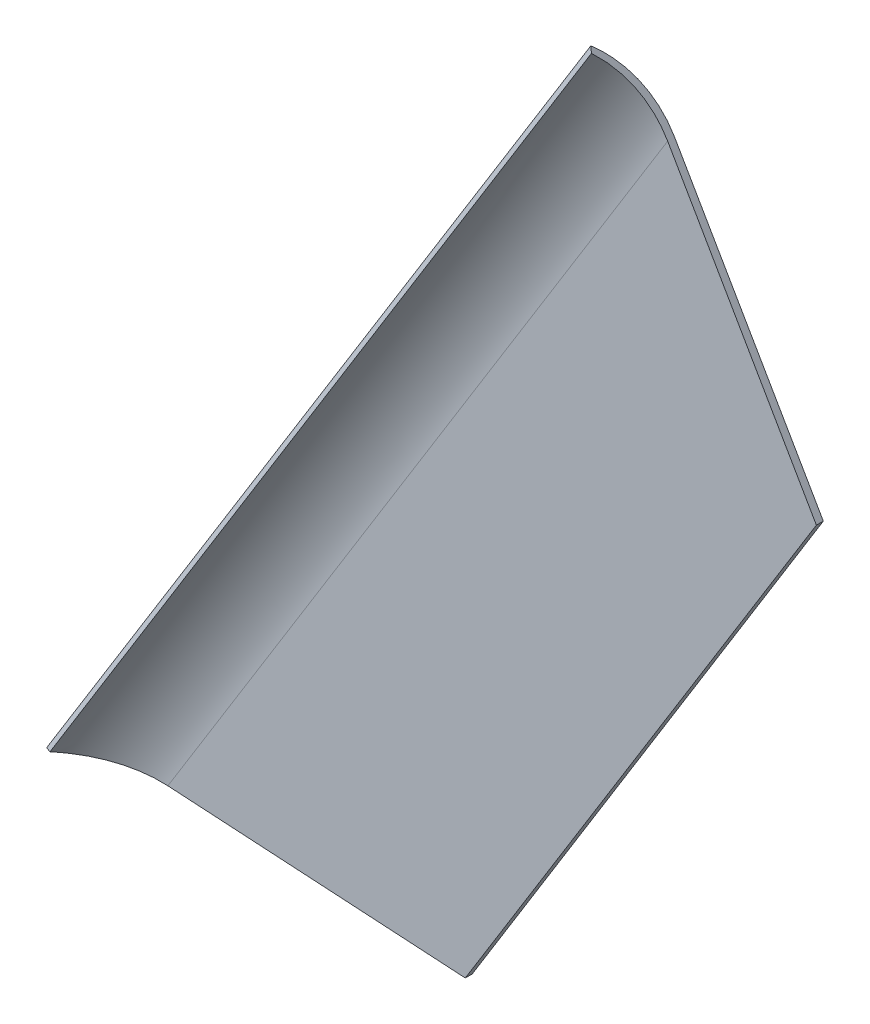
from build123d import *

# Parameters (mm, degrees)
BOSS_EXTRUDE1_DEPTH      = 1.5875
BOSS_EXTRUDE3_DEPTH      = 120
BOSS_EXTRUDE3_DEPTH_BACK = 120
CUT_EXTRUDE1_DEPTH       = 182.234838864


with BuildPart() as part:
    # Sketch1 → Boss-Extrude1 (new body)
    with BuildSketch(Plane.XY):
        Polygon((-55.589527783, -99.278633486), (-123.629375351, -95.224778061), (-9.287976323, 89.663408039), (24.731947461, 30.599888109), (-15.428790161, -34.339372689), align=None)
    extrude(amount=BOSS_EXTRUDE1_DEPTH)

    # Sketch4 → Boss-Extrude3 (add, two sides: drawn at the far end of the back side and taken through both)
    with BuildSketch(Plane(origin=(-19.629912529, -31.741249903, 0), x_dir=(0.8504980945941722, -0.5259781279594072, 0), z_dir=(0.5259781279594072, 0.8504980945941724, 0)).offset(-BOSS_EXTRUDE3_DEPTH_BACK)):
        with BuildLine():
            Line((-55.060397672, -1.5875), (-55.060397672, 0))
            add(Edge.make_bspline(
                [(-55.060397672, 0), (-65.213115138, 0), (-72.548531989, -8.632316441)],
                knots=[0.320978727, 0.320978727, 0.320978727, 1.185471829, 1.185471829, 1.185471829], degree=2, weights=[1, 0.908026935, 1]))
            ThreePointArc((-72.548531989, -8.632316441), (-72.721094469, -8.860608628), (-72.890676993, -9.091123051))
            Line((-72.890676993, -9.091123051), (-72.745996539, -9.14666735))
            Line((-72.745996539, -9.14666735), (-71.891585739, -9.474684354))
            add(Edge.make_bspline(
                [(-55.060397672, -1.5875), (-64.677105487, -1.5875), (-71.891585739, -9.474684354)],
                knots=[3.462571381, 3.462571381, 3.462571381, 4.286530008, 4.286530008, 4.286530008], degree=2, weights=[1, 0.916330054, 1]))
        make_face()
    extrude(amount=BOSS_EXTRUDE3_DEPTH + BOSS_EXTRUDE3_DEPTH_BACK)

    # Sketch5 → Cut-Extrude1 (cut, through all)
    with BuildSketch(Plane(origin=(0, 0, 0), x_dir=(-1, 0, 0), z_dir=(0, 0, -1))):
        Polygon((9.287976323, 89.663408039), (21.860519309, 111.491165443), (10.387842561, 118.099298331), (-2.424711001, 95.854847771), align=None)
        Polygon((123.629375351, -95.224778061), (148.774461323, -93.726618573), (149.561894462, -106.94288435), (123.936787337, -108.46964379), align=None)
    extrude(amount=-CUT_EXTRUDE1_DEPTH, mode=Mode.SUBTRACT)


solid = part.part
